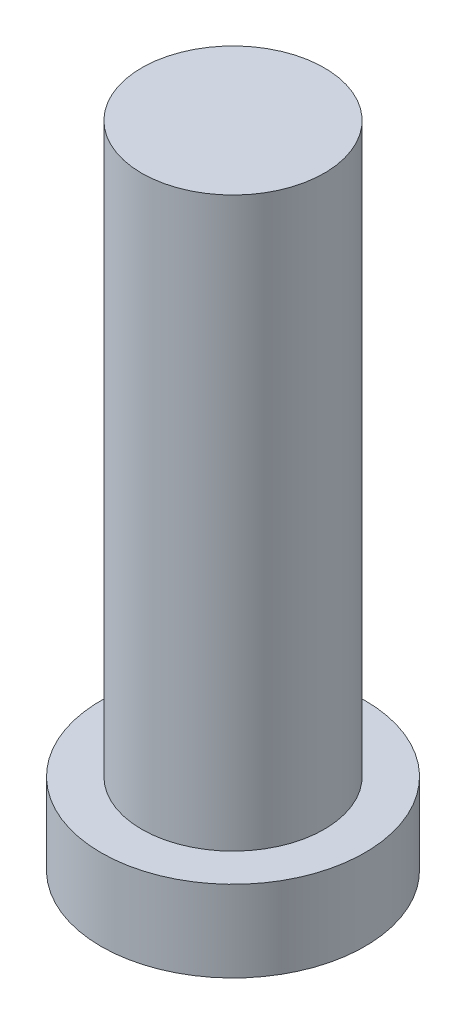
from build123d import *

# Parameters (mm, degrees)
SKETCH2_R           = 2.25
BOSS_EXTRUDE1_DEPTH = 14
SKETCH2_3_R         = 3.25
BOSS_EXTRUDE2_DEPTH = 2


with BuildPart() as part:
    # Sketch2 → Boss-Extrude1 (new body)
    with BuildSketch(Plane(origin=(0, 0, 0), x_dir=(1, 0, 0), z_dir=(0, 1, 0))):
        Circle(SKETCH2_R)
    extrude(amount=BOSS_EXTRUDE1_DEPTH)

    # Sketch2<3> → Boss-Extrude2 (add)
    with BuildSketch(Plane(origin=(0, 0, 0), x_dir=(1, 0, 0), z_dir=(0, 1, 0))):
        Circle(SKETCH2_3_R)
    extrude(amount=-BOSS_EXTRUDE2_DEPTH)


solid = part.part
